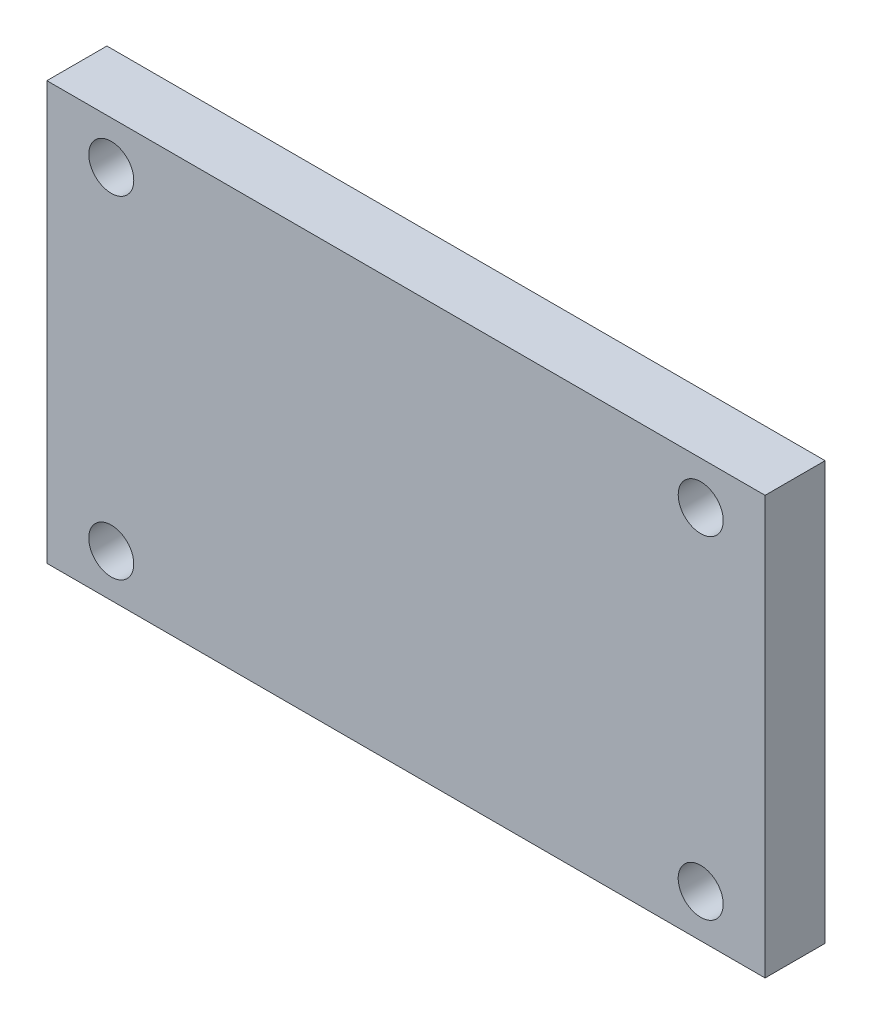
from build123d import *

# Parameters (mm, degrees)
SKETCH_1_W      = 33.503
SKETCH_1_H      = 19.5
SKETCH_1_R      = 1.05
EXTRUDE_1_DEPTH = 2.8


with BuildPart() as part:
    # 草图1 → 凸台-拉伸1 (new body)
    with BuildSketch(Plane.XY):
        with Locations((16.7515, -9.75)):
            Rectangle(SKETCH_1_W, SKETCH_1_H)
        with Locations((3.003, -2)):
            Circle(SKETCH_1_R, mode=Mode.SUBTRACT)
        with Locations(Location((3.003, -17.5, 0), (0, 0, 180))):
            Circle(SKETCH_1_R, mode=Mode.SUBTRACT)
        with Locations((30.5, -17.5)):
            Circle(SKETCH_1_R, mode=Mode.SUBTRACT)
        with Locations(Location((30.5, -2, 0), (0, 0, 180))):
            Circle(SKETCH_1_R, mode=Mode.SUBTRACT)
    extrude(amount=EXTRUDE_1_DEPTH)


solid = part.part
